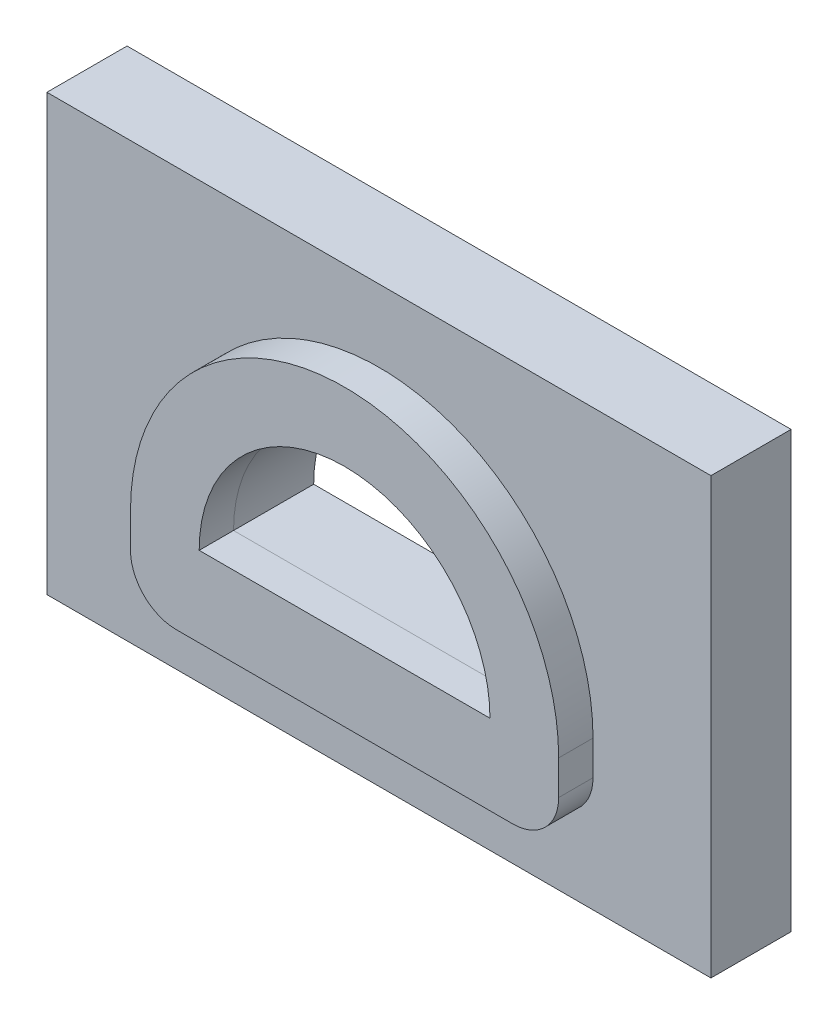
from build123d import *

# Parameters (mm, degrees)
CAP_ALIGNMENT_LIP_DEPTH = 1.5
SKETCH1_3_W             = 29
SKETCH1_3_H             = 19
CAP_BODY_DEPTH          = 3.5
LIP_CORNER_FILLET_R     = 2


with BuildPart() as part:
    # Sketch1 → cap alignment lip (new body)
    with BuildSketch(Plane.XY):
        with BuildLine():
            ThreePointArc((11.5, 0), (2.15, 9.35), (-7.2, 0))
            Line((-7.2, 0), (-7.2, -3.5))
            Line((-7.2, -3.5), (11.5, -3.5))
            Line((11.5, -3.5), (11.5, 0))
        make_face()
        with BuildLine():
            Line((8.5, 0), (-4.2, 0))
            ThreePointArc((-4.2, 0), (2.15, 6.35), (8.5, 0))
        make_face(mode=Mode.SUBTRACT)
    extrude(amount=CAP_ALIGNMENT_LIP_DEPTH)

    # lip corner fillet
    lip_corner_fillet_edges = [part.edges().sort_by_distance(p)[0] for p in [
        (-7.2, -3.5, 0.75),
        (11.5, -3.5, 0.75),
    ]]
    fillet(lip_corner_fillet_edges, radius=LIP_CORNER_FILLET_R)


with BuildPart() as body_2:
    # Sketch1<3> → cap body (new body)
    with BuildSketch(Plane.XY):
        with Locations((2.15, 3)):
            Rectangle(SKETCH1_3_W, SKETCH1_3_H)
        with BuildLine():
            Line((8.5, 0), (-4.2, 0))
            ThreePointArc((-4.2, 0), (2.15, 6.35), (8.5, 0))
        make_face(mode=Mode.SUBTRACT)
    extrude(amount=-CAP_BODY_DEPTH)


solid = Compound([part.part, body_2.part])
